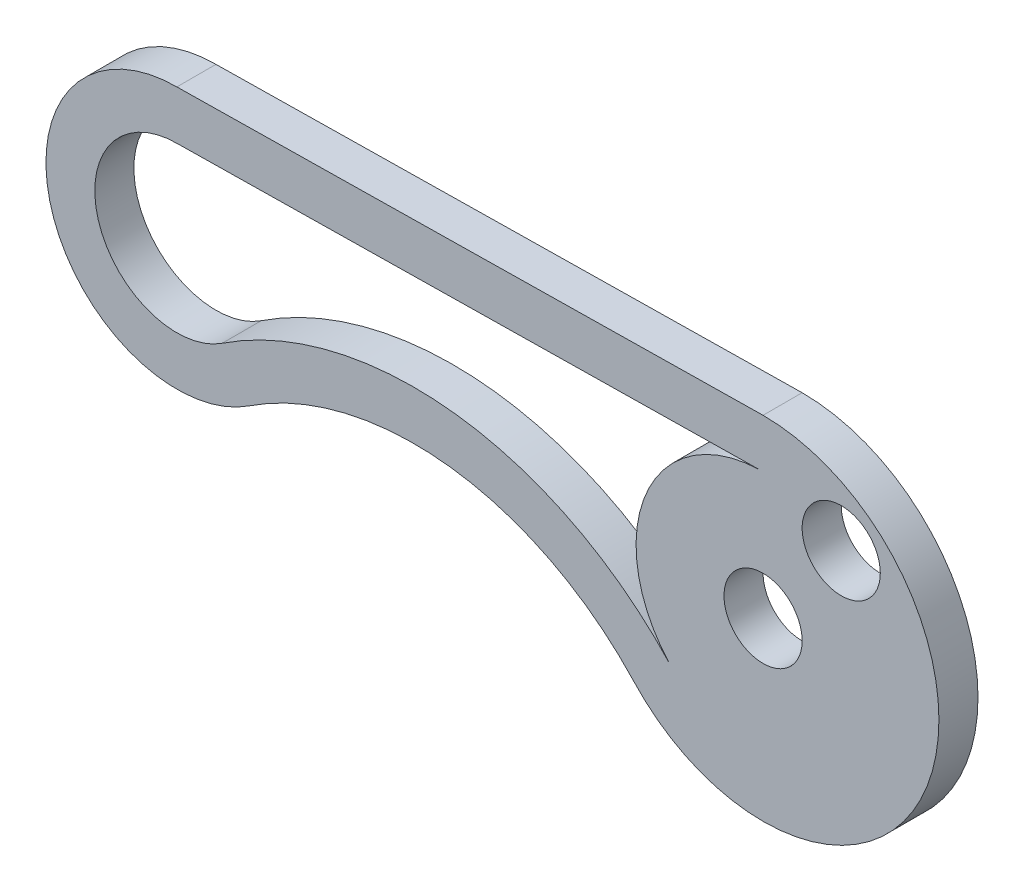
from build123d import *

# Parameters (mm, degrees)
SKETCH1_R           = 2
BOSS_EXTRUDE1_DEPTH = 2


with BuildPart() as part:
    # Sketch1 → Boss-Extrude1 (new body)
    with BuildSketch(Plane.XY):
        with BuildLine():
            Line((-1.2887257, 9.27170727), (-31.0207003, 8.828891045))
            ThreePointArc((-31.0207003, 8.828891045), (-37.4360697, 0.196784564), (-27.320647525, -3.456770014))
            ThreePointArc((-27.320647525, -3.456770014), (-17.039618289, -1.022120458), (-7.632023625, -5.830887792))
            ThreePointArc((-7.632023625, -5.830887792), (7.224276423, -3.332674299), (-1.0207003, 9.275699134))
            Line((-1.0207003, 9.275699134), (-1.2887257, 9.27170727))
        make_face()
        with BuildLine():
            ThreePointArc((-28.701264232, -1.372568126), (-35.044639656, 0.925598871), (-31.004247939, 6.328858821))
            Line((-31.004247939, 6.328858821), (-1.231370803, 6.772284233))
            ThreePointArc((-1.231370803, 6.772284233), (-7.016861205, 2.784893108), (-5.795544924, -4.134613646))
            ThreePointArc((-5.795544924, -4.134613646), (-16.740328258, 1.459899985), (-28.701264232, -1.372568126))
        make_face(mode=Mode.SUBTRACT)
        with Locations((-1.0207003, 0.275699134)):
            Circle(SKETCH1_R, mode=Mode.SUBTRACT)
        with BuildLine():
            ThreePointArc((1.370109873, 4.088050996), (2.354151579, 7.175485919), (4.9792997, 5.275699134))
            ThreePointArc((4.9792997, 5.275699134), (4.07225701, 3.60075307), (2.173855381, 3.44505459))
            ThreePointArc((2.173855381, 3.44505459), (1.729909605, 3.713961516), (1.370109873, 4.088050996))
        make_face(mode=Mode.SUBTRACT)
    extrude(amount=BOSS_EXTRUDE1_DEPTH)


solid = part.part
